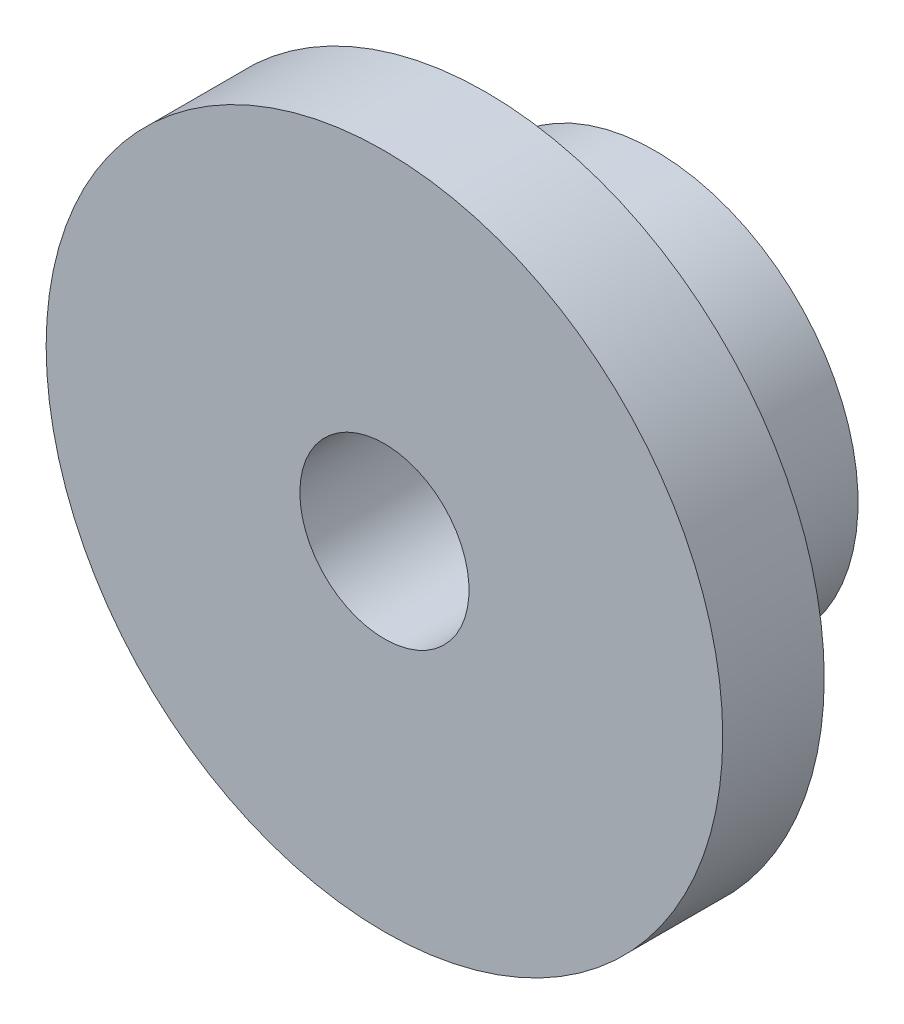
from build123d import *

# Parameters (mm, degrees)
SKETCH1_R               = 10
BOSS_EXTRUDE1_DEPTH     = 3
SKETCH2_R               = 6
BOSS_EXTRUDE2_DEPTH     = 5
TAP_DRILL_FOR_M6_TAP1_D = 5


with BuildPart() as part:
    # Sketch1 → Boss-Extrude1 (new body)
    with BuildSketch(Plane.XY):
        Circle(SKETCH1_R)
    extrude(amount=BOSS_EXTRUDE1_DEPTH)

    # Sketch2 → Boss-Extrude2 (add)
    with BuildSketch(Plane(origin=(0, 0, 0), x_dir=(-1, 0, 0), z_dir=(0, 0, -1))):
        Circle(SKETCH2_R)
    extrude(amount=BOSS_EXTRUDE2_DEPTH)

    # Tap Drill for M6 Tap1 (through all)
    with Locations(Plane(origin=(0, 0, -5), x_dir=(-1, 0, 0), z_dir=(0, 0, -1))):
        with Locations((0, 0)):
            Hole(TAP_DRILL_FOR_M6_TAP1_D / 2)


solid = part.part
